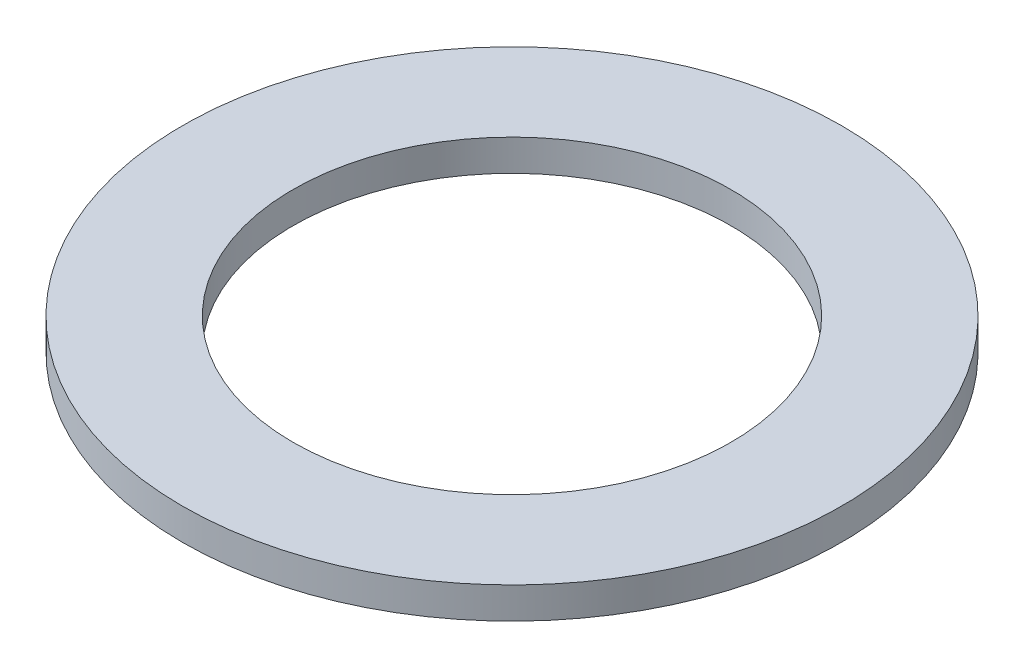
from build123d import *

# Parameters (mm, degrees)
SKETCH1_R           = 10.499999939
SKETCH1_R_2         = 6.977
BOSS_EXTRUDE1_DEPTH = 1


with BuildPart() as part:
    # Sketch1 → Boss-Extrude1 (new body)
    with BuildSketch(Plane(origin=(0, 0, 0), x_dir=(1, 0, 0), z_dir=(0, 1, 0))):
        with Locations(Location((0, 0, 0), (0, 0, 270))):
            Circle(SKETCH1_R)
        with Locations(Location((0, 0, 0), (0, 0, 270))):
            Circle(SKETCH1_R_2, mode=Mode.SUBTRACT)
    extrude(amount=BOSS_EXTRUDE1_DEPTH)


solid = part.part
